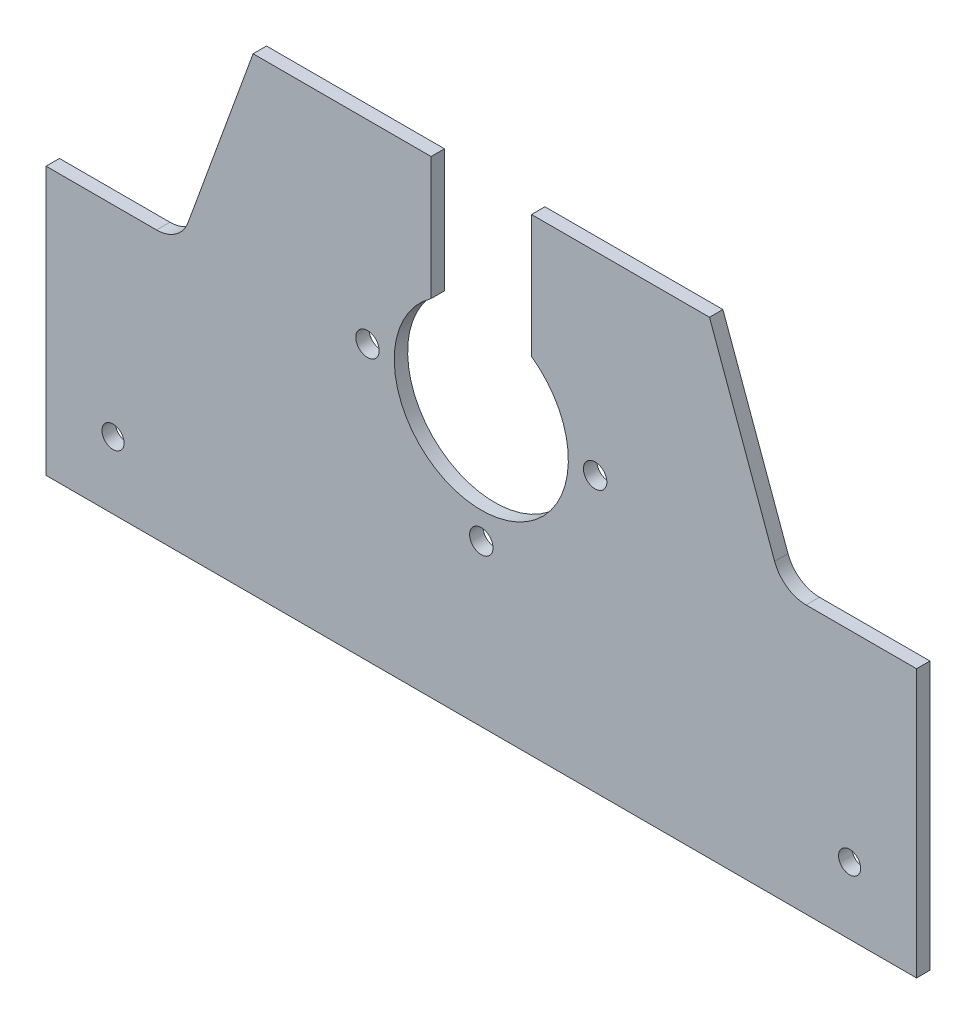
from build123d import *

# Parameters (mm, degrees)
EXTRUDE_1_DEPTH     = 2
SKETCH_2_R          = 1.65
CUT_EXTRUDE_1_DEPTH = 2
SKETCH_3_R          = 1.75
SKETCH_3_R_2        = 13
CUT_EXTRUDE_2_DEPTH = 2
SKETCH_4_W          = 15
SKETCH_4_H          = 22.74802609
CUT_EXTRUDE_3_DEPTH = 5


with BuildPart() as part:
    # 草图1 → 凸台-拉伸1 (new body)
    with BuildSketch(Plane.XY):
        with BuildLine():
            Line((-43.802574587, 23.289899283), (-34.080892972, 50))
            Line((-34.080892972, 50), (34.080892972, 50))
            Line((34.080892972, 50), (43.802574587, 23.289899283))
            ThreePointArc((43.802574587, 23.289899283), (45.633155509, 20.904239779), (48.501037691, 20))
            Line((48.501037691, 20), (65, 20))
            Line((65, 20), (65, -20))
            Line((65, -20), (-65, -20))
            Line((-65, -20), (-65, 20))
            Line((-65, 20), (-48.501037691, 20))
            ThreePointArc((-48.501037691, 20), (-45.633155509, 20.904239779), (-43.802574587, 23.289899283))
        make_face()
    extrude(amount=EXTRUDE_1_DEPTH)

    # 草图2 → 切除-拉伸1 (cut)
    with BuildSketch(Plane.XY):
        with Locations((-55, -10)):
            Circle(SKETCH_2_R)
        with Locations(Location((55, -10, 0), (0, 0, 180))):
            Circle(SKETCH_2_R)
    extrude(amount=CUT_EXTRUDE_1_DEPTH, mode=Mode.SUBTRACT)

    # 草图3 → 切除-拉伸2 (cut)
    with BuildSketch(Plane.XY):
        with Locations((0, 38)):
            Circle(SKETCH_3_R)
        with Locations((17, 21)):
            Circle(SKETCH_3_R)
        with Locations((0, 4)):
            Circle(SKETCH_3_R)
        with Locations((-17, 21)):
            Circle(SKETCH_3_R)
        with Locations((0, 21)):
            Circle(SKETCH_3_R_2)
    extrude(amount=CUT_EXTRUDE_2_DEPTH, mode=Mode.SUBTRACT)

    # 草图4 → 切除-拉伸3 (cut, symmetric)
    with BuildSketch(Plane.XY.offset(2)):
        with Locations((0, 38.625986955)):
            Rectangle(SKETCH_4_W, SKETCH_4_H)
    extrude(amount=CUT_EXTRUDE_3_DEPTH, both=True, mode=Mode.SUBTRACT)


solid = part.part
